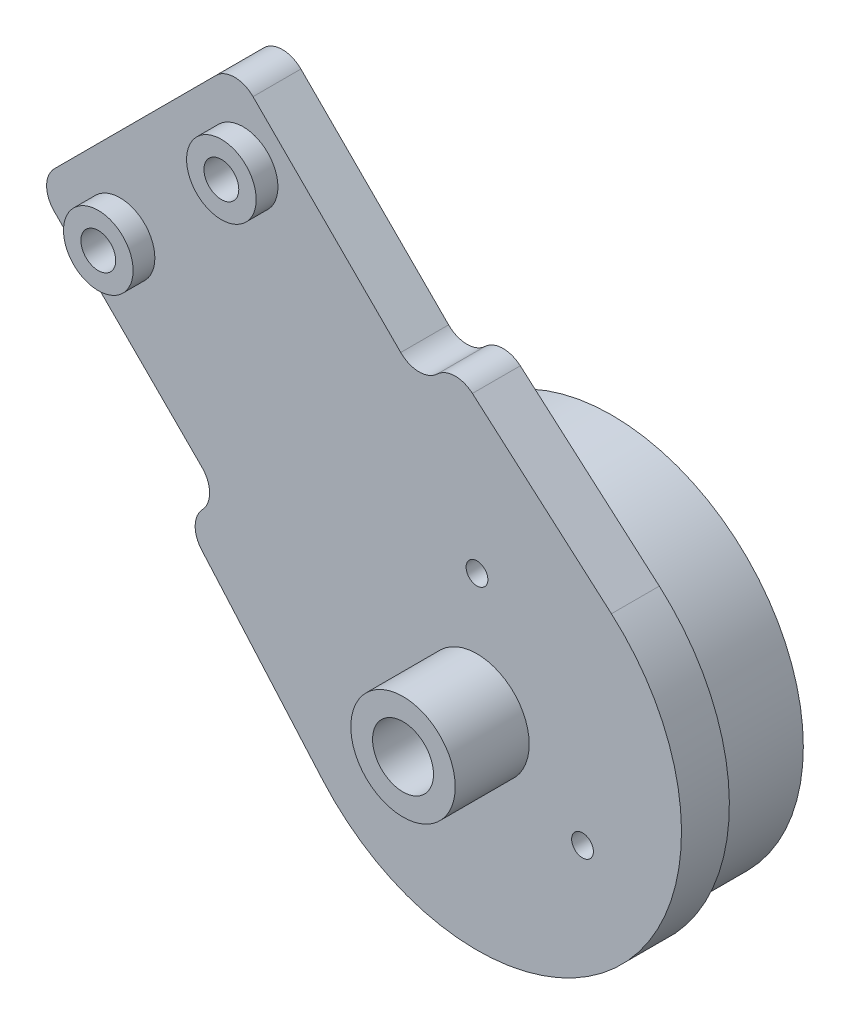
from build123d import *

# Parameters (mm, degrees)
SKETCH5_R           = 10
SKETCH5_R_2         = 1
BOSS_EXTRUDE1_DEPTH = 2.75
BOSS_EXTRUDE2_START = -1
SKETCH6_R           = 10
BOSS_EXTRUDE2_DEPTH = 1
BOSS_EXTRUDE3_START = 5
SKETCH7_R           = 11
SKETCH7_R_2         = 10
BOSS_EXTRUDE3_DEPTH = 5
FILLET3_R           = 1.5
FILLET4_R           = 1.5
SKETCH8_R           = 2
SKETCH8_R_2         = 1
BOSS_EXTRUDE4_DEPTH = 1.25
SKETCH10_R          = 1.75
CUT_EXTRUDE1_DEPTH  = 1
BOSS_EXTRUDE5_START = 4.25
SKETCH11_R          = 3
SKETCH11_R_2        = 1.75
BOSS_EXTRUDE5_DEPTH = 4.25
SKETCH12_R          = 0.625
CUT_EXTRUDE2_DEPTH  = 4.25


with BuildPart() as part:
    # Sketch5 → Boss-Extrude1 (new body)
    with BuildSketch(Plane.XY):
        with BuildLine():
            Line((80.042315229, 25.346657551), (68.62261852, 13.926960842))
            Line((68.62261852, 13.926960842), (79.229220238, 3.320359124))
            Line((79.229220238, 3.320359124), (77.226312736, 1.317451622))
            Line((77.226312736, 1.317451622), (85.115436747, -7.724767261))
            ThreePointArc((85.115436747, -7.724767261), (102.277780749, -8.308504679), (101.694043331, 8.853839323))
            Line((101.694043331, 8.853839323), (92.651824448, 16.742963335))
            Line((92.651824448, 16.742963335), (90.648916946, 14.740055833))
            Line((90.648916946, 14.740055833), (80.042315229, 25.346657551))
        make_face()
        with Locations((93.96927607, 0)):
            Circle(SKETCH5_R, mode=Mode.SUBTRACT)
        with Locations((80.534247228, 20.506096654)):
            Circle(SKETCH5_R_2, mode=Mode.SUBTRACT)
        with Locations((73.463179416, 13.435028843)):
            Circle(SKETCH5_R_2, mode=Mode.SUBTRACT)
    extrude(amount=BOSS_EXTRUDE1_DEPTH)

    # Sketch6 → Boss-Extrude2 (add)
    with BuildSketch(Plane.XY.offset(2.75).offset(BOSS_EXTRUDE2_START)):
        with Locations((93.96927607, 0)):
            Circle(SKETCH6_R)
    extrude(amount=BOSS_EXTRUDE2_DEPTH)

    # Sketch7 → Boss-Extrude3 (add)
    with BuildSketch(Plane(origin=(0, 0, 0), x_dir=(-1, 0, 0), z_dir=(0, 0, -1)).offset(BOSS_EXTRUDE3_START)):
        with Locations(Location((-93.96927607, 0, 0), (0, 0, 180))):
            Circle(SKETCH7_R)
        with Locations((-93.96927607, 0)):
            Circle(SKETCH7_R_2, mode=Mode.SUBTRACT)
    extrude(amount=-BOSS_EXTRUDE3_DEPTH)

    # Fillet3
    fillet3_edges = [part.edges().sort_by_distance(p)[0] for p in [
        (68.62261852, 13.926960842, 1.375),
        (80.042315229, 25.346657551, 1.375),
        (90.648916946, 14.740055833, 1.375),
        (79.229220238, 3.320359124, 1.375),
    ]]
    fillet(fillet3_edges, radius=FILLET3_R)

    # Fillet4
    fillet4_edges = [part.edges().sort_by_distance(p)[0] for p in [
        (77.226312736, 1.317451622, 1.375),
        (92.651824448, 16.742963335, 1.375),
    ]]
    fillet(fillet4_edges, radius=FILLET4_R)

    # Sketch8 → Boss-Extrude4 (add)
    # profile 1 of 2: a face of its own
    with BuildSketch(Plane.XY.offset(2.75)):
        with Locations((73.463179416, 13.435028843)):
            Circle(SKETCH8_R)
        with Locations((73.463179416, 13.435028843)):
            Circle(SKETCH8_R_2, mode=Mode.SUBTRACT)
    # profile 2 of 2: a face of its own
    with BuildSketch(Plane.XY.offset(2.75)):
        with Locations((80.534247228, 20.506096654)):
            Circle(SKETCH8_R)
        with Locations((80.534247228, 20.506096654)):
            Circle(SKETCH8_R_2, mode=Mode.SUBTRACT)
    extrude(amount=BOSS_EXTRUDE4_DEPTH)

    # Sketch10 → Cut-Extrude1 (cut)
    with BuildSketch(Plane.XY.offset(2.75)):
        with Locations((93.96927607, 0)):
            Circle(SKETCH10_R)
    extrude(amount=-CUT_EXTRUDE1_DEPTH, mode=Mode.SUBTRACT)

    # Sketch11 → Boss-Extrude5 (add)
    with BuildSketch(Plane.XY.offset(2.75).offset(BOSS_EXTRUDE5_START)):
        with Locations((93.96927607, 0)):
            Circle(SKETCH11_R)
        with Locations((93.96927607, 0)):
            Circle(SKETCH11_R_2, mode=Mode.SUBTRACT)
    extrude(amount=-BOSS_EXTRUDE5_DEPTH)

    # Sketch12 → Cut-Extrude2 (cut)
    with BuildSketch(Plane.XY.offset(2.75)):
        with Locations((93.96927607, 7)):
            Circle(SKETCH12_R)
        with Locations((100.031453897, -3.5)):
            Circle(SKETCH12_R)
        with Locations((87.907098244, -3.5)):
            Circle(SKETCH12_R)
    extrude(amount=-CUT_EXTRUDE2_DEPTH, mode=Mode.SUBTRACT)


solid = part.part
